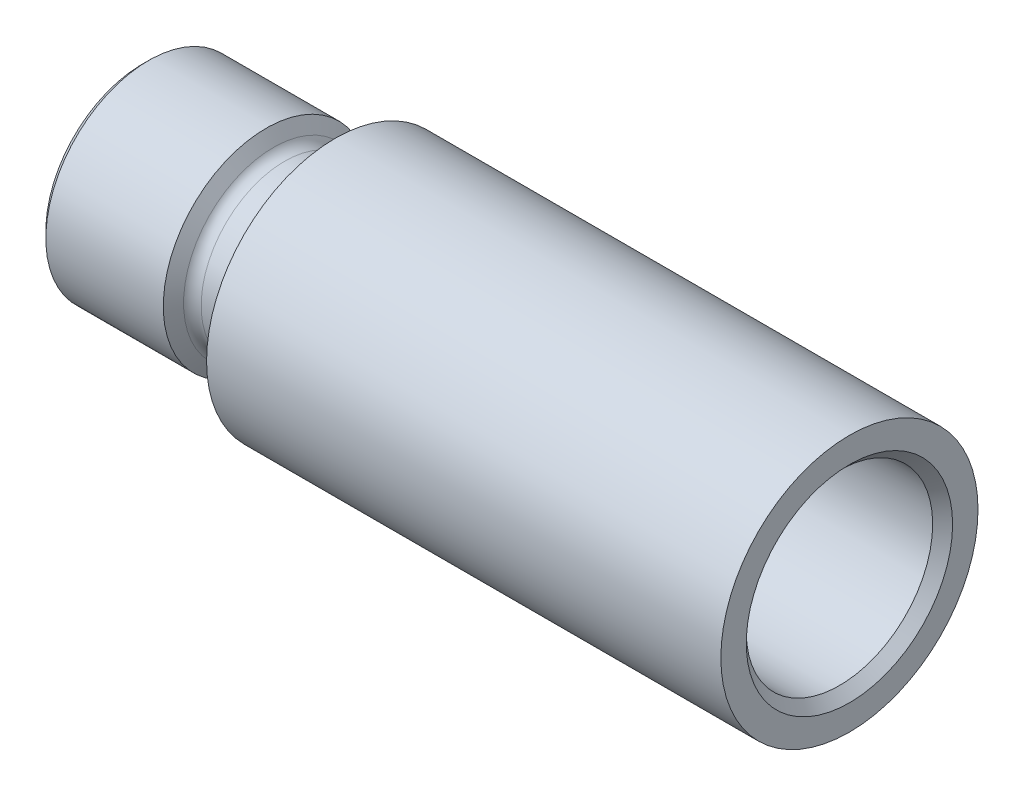
from build123d import *

# Parameters (mm, degrees)
M16X1_5_GEWINDEBOHRUNG1_D           = 14.5
M16X1_5_GEWINDEBOHRUNG1_DEPTH       = 27.5
M16X1_5_GEWINDEBOHRUNG1_CSINK_D     = 16.05
M16X1_5_GEWINDEBOHRUNG1_CSINK_ANGLE = 90
M16X1_5_GEWINDEBOHRUNG1_TIP         = 4.356239488
FASE1_SIZE                          = 0.5


with BuildPart() as part:
    # Skizze1 → Rotation1 (revolve)
    with BuildSketch(Plane.XY, mode=Mode.PRIVATE) as rotation1_sk:
        Polygon((55, 4), (0, 4), (0, 8), (15, 8), (15, 10), (55, 10), align=None)
    revolve(rotation1_sk.sketch.rotate(Axis((0, 0, 0), (1, 0, 0)), 90), axis=Axis((0, 0, 0), (1, 0, 0)))

    # M16x1.5 Gewindebohrung1
    with Locations(Plane(origin=(55, 0, 0), x_dir=(0, 0, -1), z_dir=(1, 0, 0))):
        with Locations((0, 0)):
            CounterSinkHole(M16X1_5_GEWINDEBOHRUNG1_D / 2, M16X1_5_GEWINDEBOHRUNG1_CSINK_D / 2, depth=M16X1_5_GEWINDEBOHRUNG1_DEPTH, counter_sink_angle=M16X1_5_GEWINDEBOHRUNG1_CSINK_ANGLE)
            with Locations((0, 0, -(M16X1_5_GEWINDEBOHRUNG1_DEPTH + M16X1_5_GEWINDEBOHRUNG1_TIP / 2))):  # 118° drill point
                Cone(0, M16X1_5_GEWINDEBOHRUNG1_D / 2, M16X1_5_GEWINDEBOHRUNG1_TIP, mode=Mode.SUBTRACT)

    # Fase1
    fase1_edges = [part.edges().sort_by_distance(p)[0] for p in [
        (0, 0, -8),
    ]]
    chamfer(fase1_edges, length=FASE1_SIZE)

    # Skizze31 → Schnitt-Rotation1 (revolve, cut)
    with BuildSketch(Plane(origin=(15, 0, 0), x_dir=(1, 0, 0), z_dir=(0, 0, 1)), mode=Mode.PRIVATE) as schnitt_rotation1_sk:
        with BuildLine():
            Line((-5.366025404, 8), (-4.788675135, 7))
            ThreePointArc((-4.788675135, 7), (-4.422649731, 6.633974596), (-3.922649731, 6.5))
            Line((-3.922649731, 6.5), (-1, 6.5))
            ThreePointArc((-1, 6.5), (-0.292893219, 6.792893219), (0, 7.5))
            Line((0, 7.5), (0, 8))
            Line((0, 8), (-5.366025404, 8))
        make_face()
    revolve(schnitt_rotation1_sk.sketch.rotate(Axis((28.677186203, 0, 0), (-1, 0, 0)), 90), axis=Axis((28.677186203, 0, 0), (-1, 0, 0)), mode=Mode.SUBTRACT)


solid = part.part
